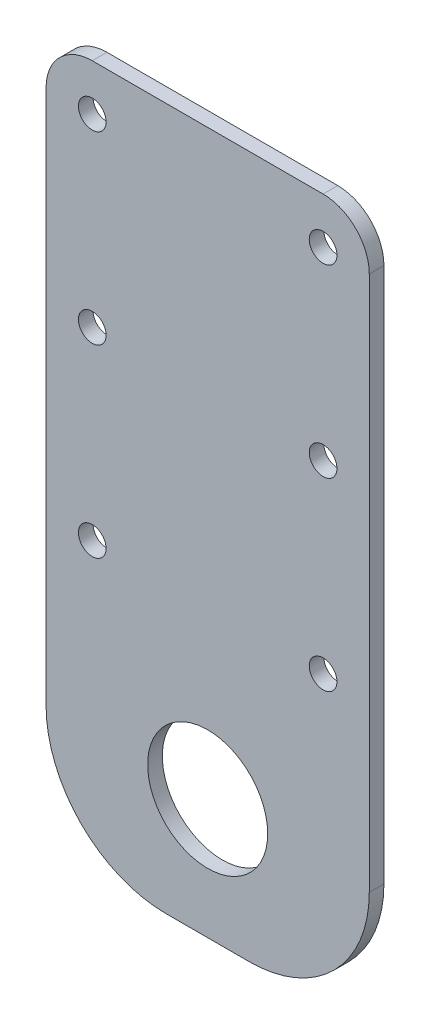
from build123d import *

# Parameters (mm, degrees)
SKETCH1_R           = 6.5
SKETCH1_R_2         = 1.5
BOSS_EXTRUDE1_DEPTH = 1.5875
FILLET1_R           = 5
FILLET2_R           = 13


with BuildPart() as part:
    # Sketch1 → Boss-Extrude1 (new body)
    with BuildSketch(Plane.XY):
        Polygon((0, 0), (0, 50), (35, 50), (35, 0), (35, -26), (0, -26), align=None)
        with Locations((17.5, -13)):
            Circle(SKETCH1_R, mode=Mode.SUBTRACT)
        with Locations((5, 45)):
            Circle(SKETCH1_R_2, mode=Mode.SUBTRACT)
        with Locations((5, 25)):
            Circle(SKETCH1_R_2, mode=Mode.SUBTRACT)
        with Locations((5, 5)):
            Circle(SKETCH1_R_2, mode=Mode.SUBTRACT)
        with Locations(Location((30, 5, 0), (0, 0, 180))):
            Circle(SKETCH1_R_2, mode=Mode.SUBTRACT)
        with Locations(Location((30, 25, 0), (0, 0, 180))):
            Circle(SKETCH1_R_2, mode=Mode.SUBTRACT)
        with Locations(Location((30, 45, 0), (0, 0, 180))):
            Circle(SKETCH1_R_2, mode=Mode.SUBTRACT)
    extrude(amount=BOSS_EXTRUDE1_DEPTH)

    # Fillet1
    fillet1_edges = [part.edges().sort_by_distance(p)[0] for p in [
        (0, 50, 0.79375),
        (35, 50, 0.79375),
    ]]
    fillet(fillet1_edges, radius=FILLET1_R)

    # Fillet2
    fillet2_edges = [part.edges().sort_by_distance(p)[0] for p in [
        (35, -26, 0.79375),
        (0, -26, 0.79375),
    ]]
    fillet(fillet2_edges, radius=FILLET2_R)


solid = part.part
